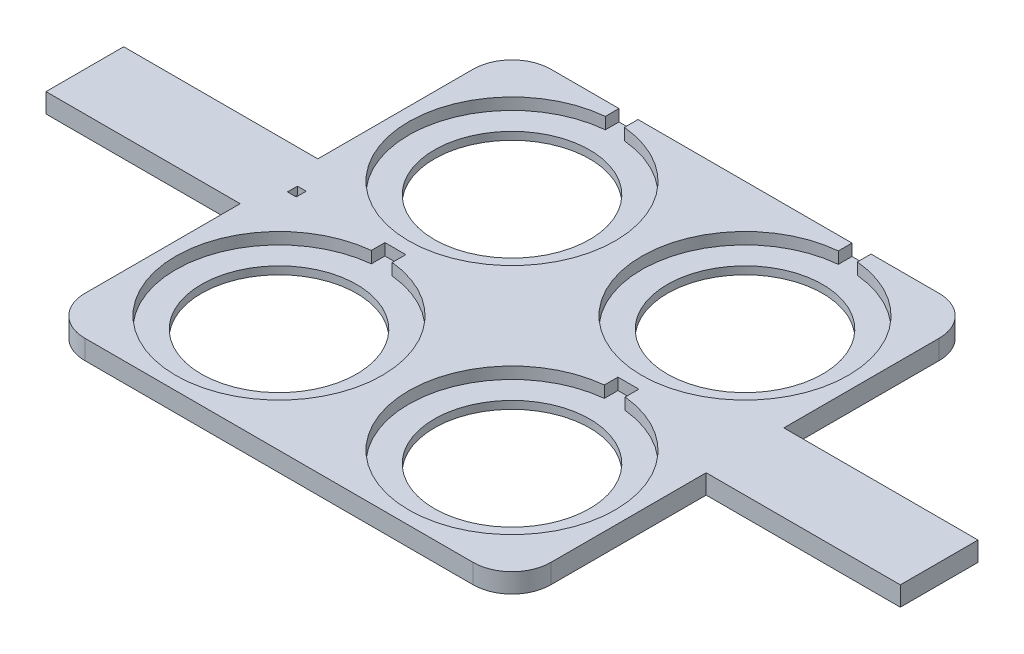
from build123d import *

# Parameters (mm, degrees)
SKETCH1_W           = 120
SKETCH1_H           = 120
BOSS_EXTRUDE1_DEPTH = 5
SKETCH2_R           = 20
CUT_EXTRUDE4_DEPTH  = 5
SKETCH3_R           = 26.6
SKETCH3_R_2         = 20
CUT_EXTRUDE5_DEPTH  = 3
SKETCH4_W           = 60
SKETCH4_H           = 5
BOSS_EXTRUDE2_DEPTH = 50
SKETCH5_W           = 60
SKETCH5_H           = 5
BOSS_EXTRUDE3_DEPTH = 50
FILLET3_R           = 10
FILLET4_R           = 10
FILLET5_R           = 10
FILLET6_R           = 10
SKETCH8_W           = 50
SKETCH8_H           = 20
CUT_EXTRUDE6_DEPTH  = 10
SKETCH10_W          = 2.261137553
SKETCH10_H          = 2.574285836
CUT_EXTRUDE7_DEPTH  = 2
SKETCH12_W          = 5.377639696
SKETCH12_H          = 6.736845814
CUT_EXTRUDE10_DEPTH = 3
SKETCH14_W          = 4.90266265
SKETCH14_H          = 7.042630192
CUT_EXTRUDE11_DEPTH = 3


with BuildPart() as part:
    # Sketch1 → Boss-Extrude1 (new body)
    with BuildSketch(Plane(origin=(0, 0, 0), x_dir=(1, 0, 0), z_dir=(0, 1, 0))):
        Rectangle(SKETCH1_W, SKETCH1_H)
    extrude(amount=BOSS_EXTRUDE1_DEPTH)

    # Sketch2 → Cut-Extrude4 (cut)
    with BuildSketch(Plane(origin=(0, 5, 0), x_dir=(1, 0, 0), z_dir=(0, 1, 0))):
        with Locations(Location((30, 30, 0), (0, 0, 270))):
            Circle(SKETCH2_R)
        with Locations(Location((-30, -30, 0), (0, 0, 270))):
            Circle(SKETCH2_R)
        with Locations(Location((30, -30, 0), (0, 0, 270))):
            Circle(SKETCH2_R)
        with Locations(Location((-30, 30, 0), (0, 0, 270))):
            Circle(SKETCH2_R)
    extrude(amount=-CUT_EXTRUDE4_DEPTH, mode=Mode.SUBTRACT)

    # Sketch3 → Cut-Extrude5 (cut)
    # profile 1 of 4: a face of its own
    with BuildSketch(Plane(origin=(0, 5, 0), x_dir=(1, 0, 0), z_dir=(0, 1, 0))):
        with Locations(Location((30, 30, 0), (0, 0, 270))):
            Circle(SKETCH3_R)
        with Locations(Location((30, 30, 0), (0, 0, 270))):
            Circle(SKETCH3_R_2, mode=Mode.SUBTRACT)
    # profile 2 of 4: a face of its own
    with BuildSketch(Plane(origin=(0, 5, 0), x_dir=(1, 0, 0), z_dir=(0, 1, 0))):
        with Locations(Location((-30, -30, 0), (0, 0, 270))):
            Circle(SKETCH3_R)
        with Locations(Location((-30, -30, 0), (0, 0, 270))):
            Circle(SKETCH3_R_2, mode=Mode.SUBTRACT)
    # profile 3 of 4: a face of its own
    with BuildSketch(Plane(origin=(0, 5, 0), x_dir=(1, 0, 0), z_dir=(0, 1, 0))):
        with Locations(Location((30, -30, 0), (0, 0, 270))):
            Circle(SKETCH3_R)
        with Locations(Location((30, -30, 0), (0, 0, 270))):
            Circle(SKETCH3_R_2, mode=Mode.SUBTRACT)
    # profile 4 of 4: a face of its own
    with BuildSketch(Plane(origin=(0, 5, 0), x_dir=(1, 0, 0), z_dir=(0, 1, 0))):
        with Locations(Location((-30, 30, 0), (0, 0, 270))):
            Circle(SKETCH3_R)
    extrude(amount=-CUT_EXTRUDE5_DEPTH, mode=Mode.SUBTRACT)

    # Sketch4 → Boss-Extrude2 (add)
    with BuildSketch(Plane(origin=(60, 0, 0), x_dir=(0, 0, -1), z_dir=(1, 0, 0))):
        with Locations((0, 2.5)):
            Rectangle(SKETCH4_W, SKETCH4_H)
    extrude(amount=BOSS_EXTRUDE2_DEPTH)

    # Sketch5 → Boss-Extrude3 (add)
    with BuildSketch(Plane.ZY.offset(60)):
        with Locations((0, 2.5)):
            Rectangle(SKETCH5_W, SKETCH5_H)
    extrude(amount=BOSS_EXTRUDE3_DEPTH)

    # Fillet3
    fillet3_edges = [part.edges().sort_by_distance(p)[0] for p in [
        (-60, 2.5, 60),
    ]]
    fillet(fillet3_edges, radius=FILLET3_R)

    # Fillet4
    fillet4_edges = [part.edges().sort_by_distance(p)[0] for p in [
        (60, 2.5, 60),
    ]]
    fillet(fillet4_edges, radius=FILLET4_R)

    # Fillet5
    fillet5_edges = [part.edges().sort_by_distance(p)[0] for p in [
        (-60, 2.5, -60),
    ]]
    fillet(fillet5_edges, radius=FILLET5_R)

    # Fillet6
    fillet6_edges = [part.edges().sort_by_distance(p)[0] for p in [
        (60, 2.5, -60),
    ]]
    fillet(fillet6_edges, radius=FILLET6_R)

    # Sketch8 → Cut-Extrude6 (cut)
    with BuildSketch(Plane(origin=(0, 5, 0), x_dir=(1, 0, 0), z_dir=(0, 1, 0))):
        with Locations((-85, 20)):
            Rectangle(SKETCH8_W, SKETCH8_H)
        with Locations((-85, -20)):
            Rectangle(SKETCH8_W, SKETCH8_H)
        with Locations((85, -20)):
            Rectangle(SKETCH8_W, SKETCH8_H)
        with Locations((85, 20)):
            Rectangle(SKETCH8_W, SKETCH8_H)
    extrude(amount=-CUT_EXTRUDE6_DEPTH, mode=Mode.SUBTRACT)

    # Sketch10 → Cut-Extrude7 (cut)
    with BuildSketch(Plane(origin=(0, 5, 0), x_dir=(1, 0, 0), z_dir=(0, 1, 0))):
        with Locations((-55.406362831, 0)):
            Rectangle(SKETCH10_W, SKETCH10_H)
    extrude(amount=-CUT_EXTRUDE7_DEPTH, mode=Mode.SUBTRACT)

    # Sketch12 → Cut-Extrude10 (cut)
    with BuildSketch(Plane(origin=(0, 5, 0), x_dir=(1, 0, 0), z_dir=(0, 1, 0))):
        with Locations((-30, -3.4)):
            Rectangle(SKETCH12_W, SKETCH12_H)
        with Locations((30, -3.4)):
            Rectangle(SKETCH12_W, SKETCH12_H)
    extrude(amount=-CUT_EXTRUDE10_DEPTH, mode=Mode.SUBTRACT)

    # Sketch14 → Cut-Extrude11 (cut)
    with BuildSketch(Plane(origin=(0, 5, 0), x_dir=(1, 0, 0), z_dir=(0, 1, 0))):
        with Locations((-30, 56.6)):
            Rectangle(SKETCH14_W, SKETCH14_H)
        with Locations((30, 56.6)):
            Rectangle(SKETCH14_W, SKETCH14_H)
    extrude(amount=-CUT_EXTRUDE11_DEPTH, mode=Mode.SUBTRACT)


solid = part.part
